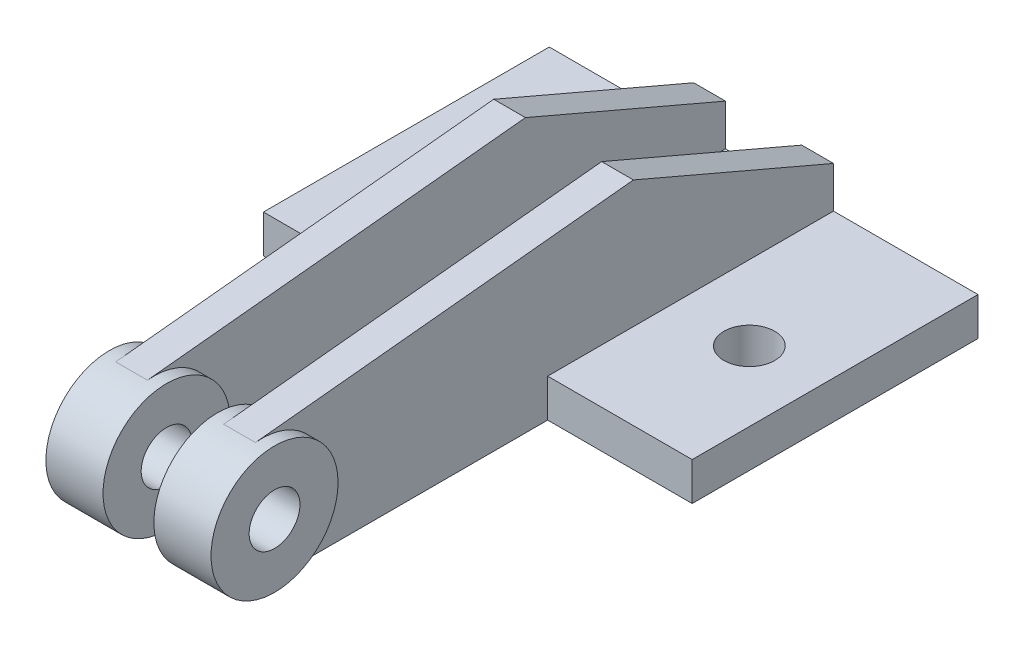
from build123d import *
from build123d.topology import SkipClean

# Parameters (mm, degrees)
SKETCH1_W           = 90
SKETCH1_H           = 12
BOSS_EXTRUDE1_DEPTH = 67.5
BOSS_EXTRUDE2_START = 12
BOSS_EXTRUDE2_DEPTH = 10
BOSS_EXTRUDE3_START = -14
SKETCH3_R           = 20
BOSS_EXTRUDE3_DEPTH = 18
HOLE1_D             = 16
HOLE2_D             = 16


with BuildPart() as part:
    # Sketch1 → Boss-Extrude1 (new, symmetric)
    with BuildSketch(Plane(origin=(0, 0, 0), x_dir=(0, 0, -1), z_dir=(1, 0, 0))):
        with Locations((45, 6)):
            Rectangle(SKETCH1_W, SKETCH1_H)
    extrude(amount=BOSS_EXTRUDE1_DEPTH, both=True)

    # Sketch2 → Boss-Extrude2 (add)
    with BuildSketch(Plane(origin=(0, 0, 0), x_dir=(0, 0, -1), z_dir=(1, 0, 0)).offset(BOSS_EXTRUDE2_START)):
        with BuildLine():
            Line((90, 12), (0, 12))
            Line((0, 12), (0, 0))
            Line((0, 0), (-90, 0))
            ThreePointArc((-90, 0), (-109.974333849, 18.987089694), (-92.023220861, 39.897401271))
            Line((-92.023220861, 39.897401271), (27, 52))
            Line((27, 52), (90, 25))
            Line((90, 25), (90, 12))
        make_face()
    boss_extrude2 = extrude(amount=BOSS_EXTRUDE2_DEPTH)

    # Sketch3 → Boss-Extrude3 (add)
    with SkipClean():  # the faces are left unmerged after this step: merging them gives an invalid solid
        with BuildSketch(Plane(origin=(22, 0, 0), x_dir=(0, 0, -1), z_dir=(1, 0, 0)).offset(BOSS_EXTRUDE3_START)):
            with Locations((-90, 20)):
                Circle(SKETCH3_R)
        boss_extrude3 = extrude(amount=BOSS_EXTRUDE3_DEPTH)

    # Mirror1: Boss-Extrude2, Boss-Extrude3 across plane
    with SkipClean():  # the faces are left unmerged after this step: merging them gives an invalid solid
        add(boss_extrude2.mirror(Plane(origin=(0, 0, 0), x_dir=(0, 0, 1), z_dir=(1, 0, 0))))
        add(boss_extrude3.mirror(Plane(origin=(0, 0, 0), x_dir=(0, 0, 1), z_dir=(1, 0, 0))))

    # Hole1 (through all)
    with Locations(Plane(origin=(26, 0, 0), x_dir=(0, 0, -1), z_dir=(1, 0, 0))):
        with Locations((-90, 20)):
            Hole(HOLE1_D / 2)

    # Hole2 (through all)
    with Locations(Plane(origin=(0, 12, 0), x_dir=(1, 0, 0), z_dir=(0, 1, 0))):
        with Locations((45.5, 40)):
            hole2 = Hole(HOLE2_D / 2)

    # Mirror2: Hole2 across plane
    with SkipClean():  # the faces are left unmerged after this step: merging them gives an invalid solid
        add(hole2.mirror(Plane(origin=(0, 0, 0), x_dir=(0, 0, 1), z_dir=(1, 0, 0))), mode=Mode.SUBTRACT)


solid = part.part
